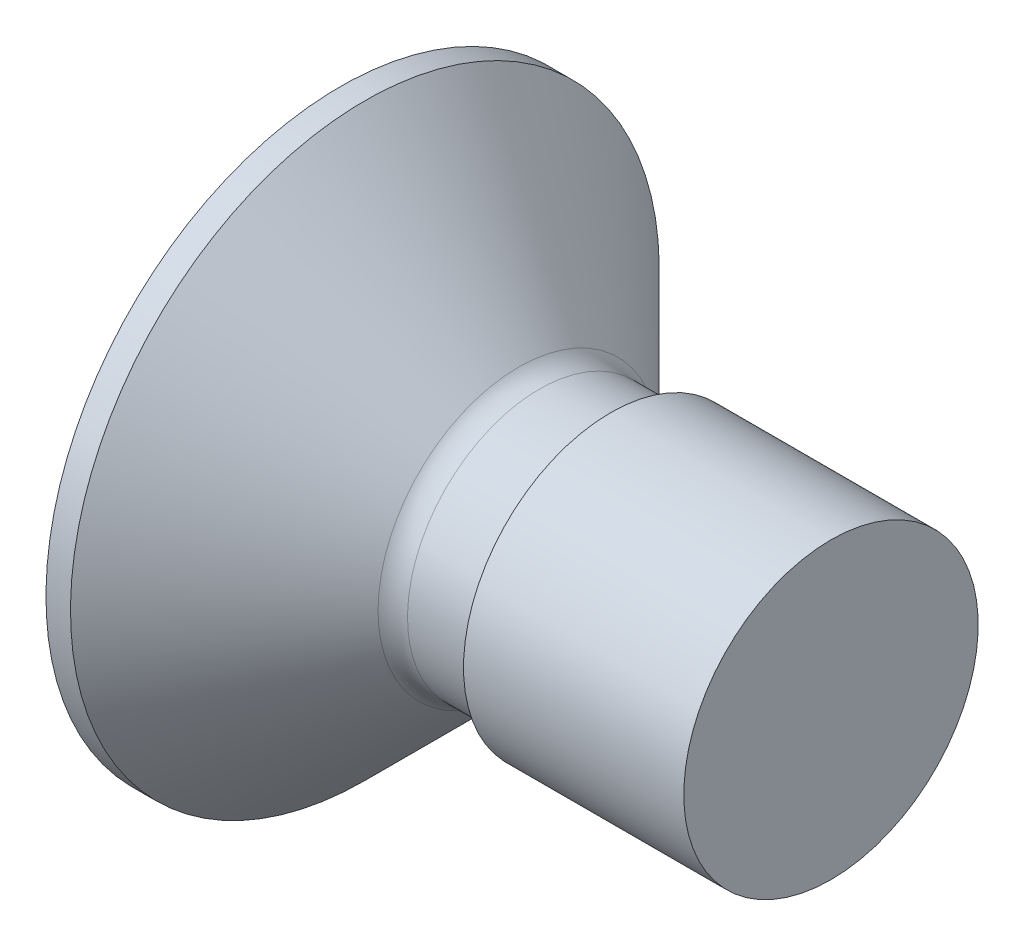
from build123d import *

# Parameters (mm, degrees)
FILLET1_R          = 0.3
CUT_EXTRUDE1_DEPTH = 0.88


with BuildPart() as part:
    # Sketch1 → Revolve1 (revolve)
    with BuildSketch(Plane.XY, mode=Mode.PRIVATE) as revolve1_sk:
        Polygon((-1.75, 0), (-1.75, 3), (-1.5, 3), (0.155, 1.345), (1.005, 1.345), (1.005, 1.5), (3.25, 1.5), (3.25, 0), align=None)
    revolve(revolve1_sk.sketch.rotate(Axis((-1.75, 0, 0), (1, 0, 0)), 180), axis=Axis((-1.75, 0, 0), (1, 0, 0)))

    # Fillet1
    fillet1_edges = [part.edges().sort_by_distance(p)[0] for p in [
        (0.155, 1.345, 0),
    ]]
    fillet(fillet1_edges, radius=FILLET1_R)

    # Sketch2 → Cut-Extrude1 (cut)
    with BuildSketch(Plane.ZY.offset(1.75)):
        with BuildLine():
            Line((-0.4, 1.8), (0.4, 1.8))
            Line((0.4, 1.8), (0.4, 1))
            ThreePointArc((0.4, 1), (0.575735931, 0.575735931), (1, 0.4))
            Line((1, 0.4), (1.8, 0.4))
            Line((1.8, 0.4), (1.8, -0.4))
            Line((1.8, -0.4), (1, -0.4))
            ThreePointArc((1, -0.4), (0.575735931, -0.575735931), (0.4, -1))
            Line((0.4, -1), (0.4, -1.8))
            Line((0.4, -1.8), (-0.4, -1.8))
            Line((-0.4, -1.8), (-0.4, -1))
            ThreePointArc((-0.4, -1), (-0.575735931, -0.575735931), (-1, -0.4))
            Line((-1, -0.4), (-1.8, -0.4))
            Line((-1.8, -0.4), (-1.8, 0.4))
            Line((-1.8, 0.4), (-1, 0.4))
            ThreePointArc((-1, 0.4), (-0.575735931, 0.575735931), (-0.4, 1))
            Line((-0.4, 1), (-0.4, 1.8))
        make_face()
    extrude(amount=-CUT_EXTRUDE1_DEPTH, mode=Mode.SUBTRACT)


solid = part.part
